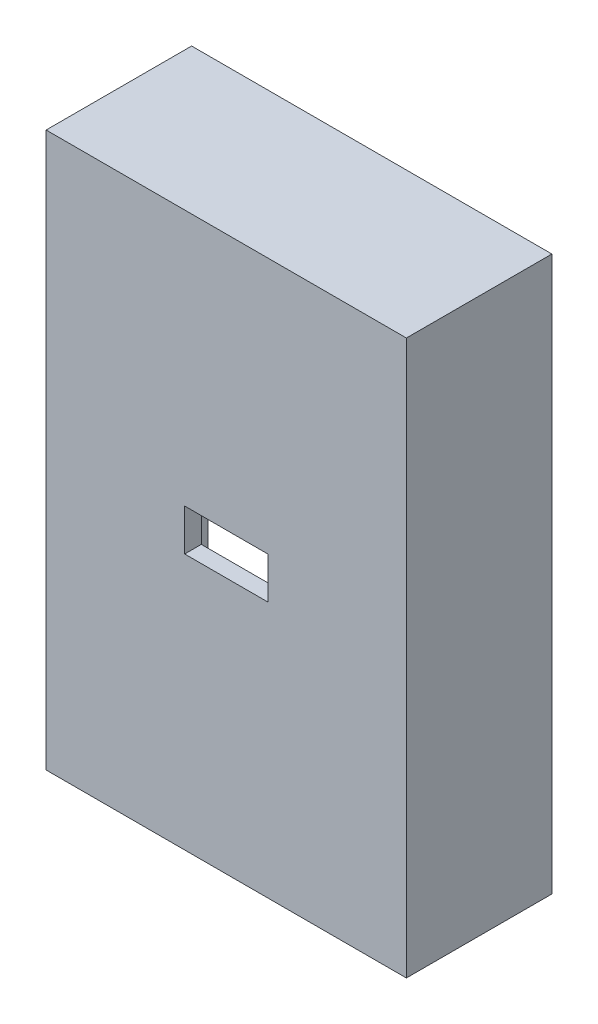
from build123d import *

# Parameters (mm, degrees)
SKETCH1_W           = 26
SKETCH1_H           = 40
SKETCH1_W_2         = 6
SKETCH1_H_2         = 3
BOSS_EXTRUDE1_DEPTH = 1.2
SKETCH2_W           = 26
SKETCH2_H           = 40
SKETCH2_W_2         = 16
SKETCH2_H_2         = 16
BOSS_EXTRUDE2_DEPTH = 1.3
SKETCH5_W           = 26
SKETCH5_H           = 40
SKETCH5_W_2         = 23.6
SKETCH5_H_2         = 37.6
BOSS_EXTRUDE3_DEPTH = 8
SKETCH6_R           = 2
CUT_EXTRUDE1_DEPTH  = 8


with BuildPart() as part:
    # Sketch1 → Boss-Extrude1 (new body)
    with BuildSketch(Plane.XY):
        with Locations((8, -8)):
            Rectangle(SKETCH1_W, SKETCH1_H)
        with Locations((8, -8)):
            Rectangle(SKETCH1_W_2, SKETCH1_H_2, mode=Mode.SUBTRACT)
    extrude(amount=BOSS_EXTRUDE1_DEPTH)

    # Sketch2 → Boss-Extrude2 (add)
    with BuildSketch(Plane(origin=(0, 0, 0), x_dir=(-1, 0, 0), z_dir=(0, 0, -1))):
        with Locations((-8, -8)):
            Rectangle(SKETCH2_W, SKETCH2_H)
        with Locations((-8, -8)):
            Rectangle(SKETCH2_W_2, SKETCH2_H_2, mode=Mode.SUBTRACT)
    extrude(amount=BOSS_EXTRUDE2_DEPTH)

    # Sketch5 → Boss-Extrude3 (add)
    with BuildSketch(Plane(origin=(0, 0, -1.3), x_dir=(-1, 0, 0), z_dir=(0, 0, -1))):
        with Locations((-8, -8)):
            Rectangle(SKETCH5_W, SKETCH5_H)
        with Locations((-8, -8)):
            Rectangle(SKETCH5_W_2, SKETCH5_H_2, mode=Mode.SUBTRACT)
    extrude(amount=BOSS_EXTRUDE3_DEPTH)

    # Sketch6 → Cut-Extrude1 (cut)
    with BuildSketch(Plane.XZ.offset(28)):
        with Locations(Location((8, -4.05, 0), (0, 0, 270))):
            Circle(SKETCH6_R)
    extrude(amount=-CUT_EXTRUDE1_DEPTH, mode=Mode.SUBTRACT)


solid = part.part
